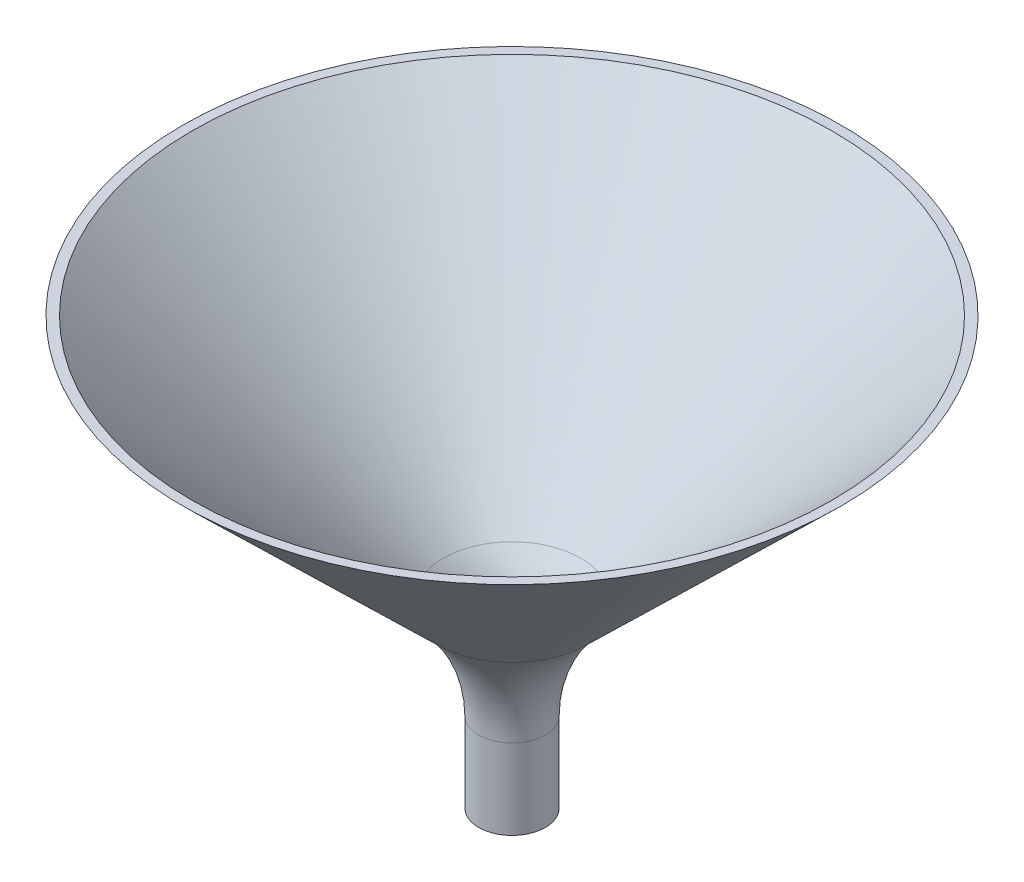
from build123d import *

# Parameters (mm, degrees)
ESQUISSE4_W        = 1.2
ESQUISSE4_H        = 7.846267026
BOSS_EXTRU_1_DEPTH = 6.35


with BuildPart() as part:
    # Esquisse1 → Révolution1 (revolve)
    with BuildSketch(Plane.XY):
        with BuildLine():
            Line((3.96875, 0), (3.96875, 9.534696006))
            ThreePointArc((3.96875, 9.534696006), (5.270377511, 15.960075858), (8.970022713, 21.372318074))
            Line((8.970022713, 21.372318074), (39.238684771, 50.8))
            Line((39.238684771, 50.8), (38.1, 50.8))
            Line((38.1, 50.8), (8.176272713, 21.707669228))
            ThreePointArc((8.176272713, 21.707669228), (4.476627511, 16.295427012), (3.175, 9.87004716))
            Line((3.175, 9.87004716), (3.175, 0))
            Line((3.175, 0), (3.96875, 0))
        make_face()
    revolve(axis=Axis((0, 0, 0), (0, 1, 0)))

    # Esquisse4 → Boss.-Extru.1 (add)
    with BuildSketch(Plane.XZ):
        Rectangle(ESQUISSE4_W, ESQUISSE4_H)
    extrude(amount=-BOSS_EXTRU_1_DEPTH)


solid = part.part
